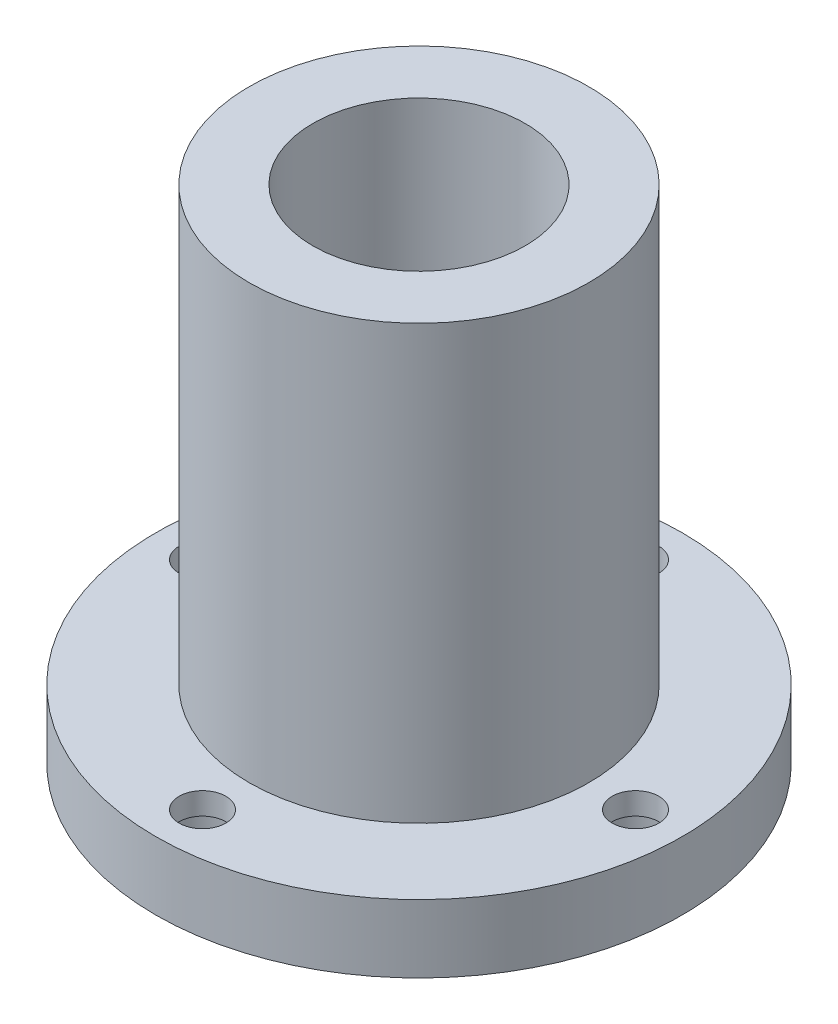
from build123d import *

# Parameters (mm, degrees)
SKETCH1_R           = 31
BOSS_EXTRUDE1_DEPTH = 8
SKETCH2_R           = 20
BOSS_EXTRUDE2_DEPTH = 51
SKETCH3_R           = 12.5
CUT_EXTRUDE1_DEPTH  = 74.505101864
SKETCH4_R           = 4.6
CUT_EXTRUDE2_DEPTH  = 5.4
SKETCH5_R           = 2.75
CUT_EXTRUDE3_DEPTH  = 70.245649683


with BuildPart() as part:
    # Sketch1 → Boss-Extrude1 (new body)
    with BuildSketch(Plane(origin=(0, 0, 0), x_dir=(1, 0, 0), z_dir=(0, 1, 0))):
        with Locations(Location((0, 0, 0), (0, 0, 270))):
            Circle(SKETCH1_R)
    extrude(amount=BOSS_EXTRUDE1_DEPTH)

    # Sketch2 → Boss-Extrude2 (add)
    with BuildSketch(Plane(origin=(0, 8, 0), x_dir=(1, 0, 0), z_dir=(0, 1, 0))):
        with Locations(Location((0, 0, 0), (0, 0, 270))):
            Circle(SKETCH2_R)
    extrude(amount=BOSS_EXTRUDE2_DEPTH)

    # Sketch3 → Cut-Extrude1 (cut, through all)
    with BuildSketch(Plane(origin=(0, 59, 0), x_dir=(1, 0, 0), z_dir=(0, 1, 0))):
        with Locations(Location((0, 0, 0), (0, 0, 270))):
            Circle(SKETCH3_R)
    extrude(amount=-CUT_EXTRUDE1_DEPTH, mode=Mode.SUBTRACT)

    # Sketch4 → Cut-Extrude2 (cut)
    with BuildSketch(Plane.XZ):
        with Locations(Location((0, -25.5, 0), (0, 0, 270))):
            Circle(SKETCH4_R)
        with Locations(Location((-25.5, 0, 0), (0, 0, 270))):
            Circle(SKETCH4_R)
        with Locations(Location((0, 25.5, 0), (0, 0, 270))):
            Circle(SKETCH4_R)
        with Locations(Location((25.5, 0, 0), (0, 0, 270))):
            Circle(SKETCH4_R)
    extrude(amount=-CUT_EXTRUDE2_DEPTH, mode=Mode.SUBTRACT)

    # Sketch5 → Cut-Extrude3 (cut, through all)
    with BuildSketch(Plane.XZ.offset(-5.4)):
        with Locations(Location((25.5, 0, 0), (0, 0, 270))):
            Circle(SKETCH5_R)
        with Locations(Location((0, -25.5, 0), (0, 0, 270))):
            Circle(SKETCH5_R)
        with Locations(Location((-25.5, 0, 0), (0, 0, 270))):
            Circle(SKETCH5_R)
        with Locations(Location((0, 25.5, 0), (0, 0, 270))):
            Circle(SKETCH5_R)
    extrude(amount=-CUT_EXTRUDE3_DEPTH, mode=Mode.SUBTRACT)


solid = part.part
